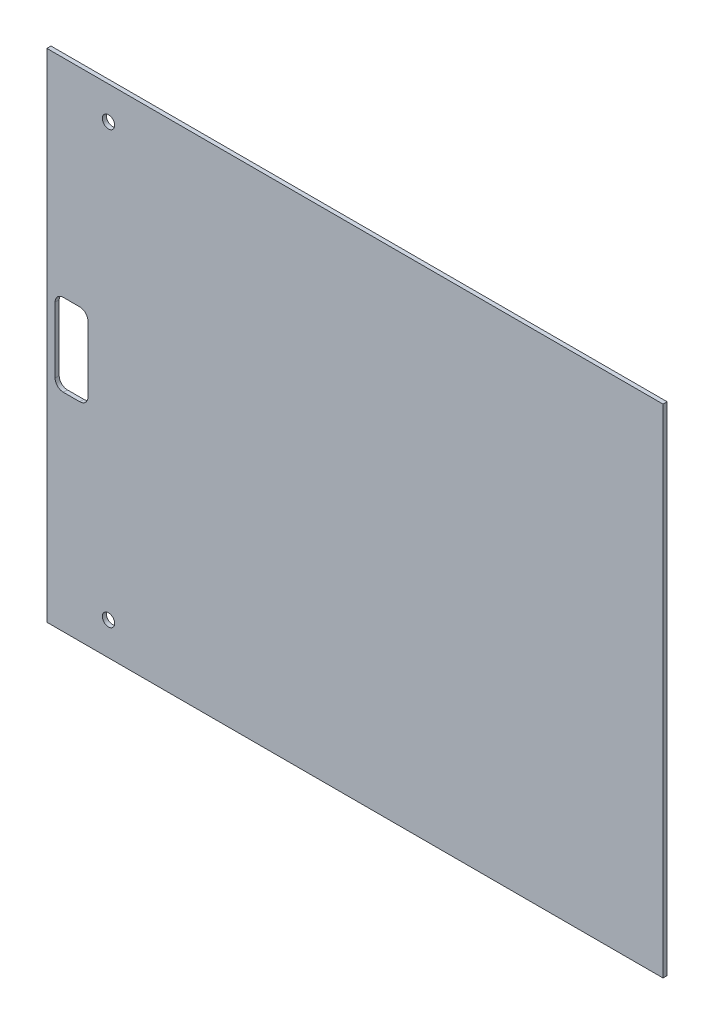
from build123d import *

# Parameters (mm, degrees)
SKETCH_1_W      = 150
SKETCH_1_H      = 121
SKETCH_1_R      = 1.5
EXTRUDE_2_DEPTH = 1


with BuildPart() as part:
    # 草图1 → 凸台-拉伸2 (new body)
    with BuildSketch(Plane.XY):
        Rectangle(SKETCH_1_W, SKETCH_1_H)
        with Locations((-60, 52.5)):
            Circle(SKETCH_1_R, mode=Mode.SUBTRACT)
        with Locations((-60, -52.5)):
            Circle(SKETCH_1_R, mode=Mode.SUBTRACT)
        with BuildLine():
            Line((-71, 10), (-67, 10))
            ThreePointArc((-67, 10), (-65.585786438, 9.414213562), (-65, 8))
            Line((-65, 8), (-65, -8))
            ThreePointArc((-65, -8), (-65.585786438, -9.414213562), (-67, -10))
            Line((-67, -10), (-71, -10))
            ThreePointArc((-71, -10), (-72.414213562, -9.414213562), (-73, -8))
            Line((-73, -8), (-73, 8))
            ThreePointArc((-73, 8), (-72.414213562, 9.414213562), (-71, 10))
        make_face(mode=Mode.SUBTRACT)
    extrude(amount=EXTRUDE_2_DEPTH)


solid = part.part
